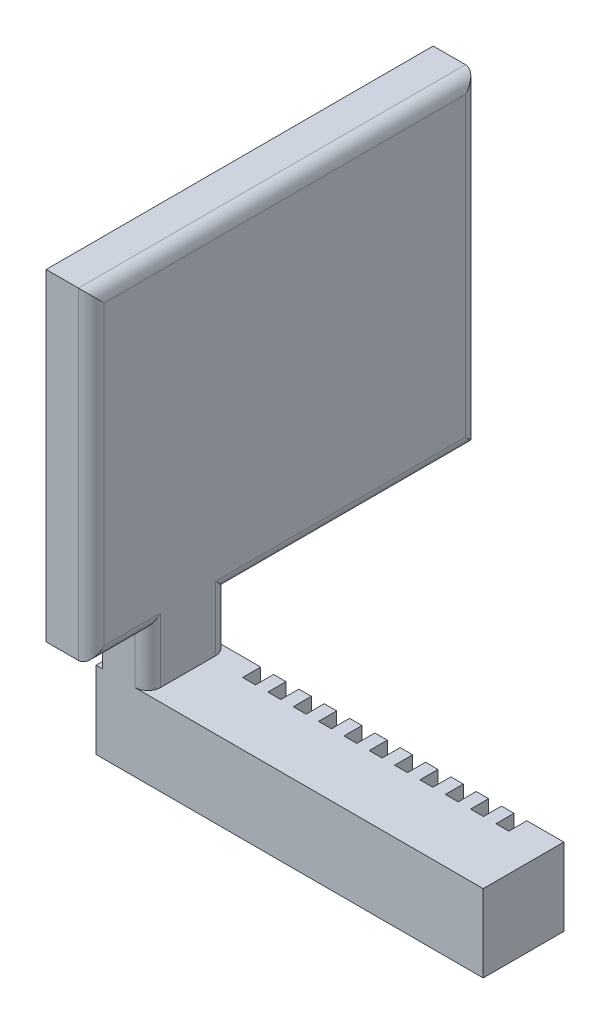
from build123d import *

# Parameters (mm, degrees)
SKETCH2_W           = 60
SKETCH2_H           = 50
BOSS_EXTRUDE1_DEPTH = 4
SKETCH3_W           = 8
SKETCH3_H           = 12.5
BOSS_EXTRUDE2_DEPTH = 20
FILLET2_R           = 2
CHAMFER2_SIZE       = 1
SKETCH4_W           = 60
SKETCH4_H           = 12.5
BOSS_EXTRUDE4_DEPTH = 12
SKETCH10_W          = 2
SKETCH10_H          = 2.8
CUT_EXTRUDE1_DEPTH  = 87.02325267
LPATTERN5_COUNT     = 11
LPATTERN5_PITCH     = 3.927


with BuildPart() as part:
    # Sketch2 → Boss-Extrude1 (new, symmetric)
    with BuildSketch(Plane(origin=(0, 0, 0), x_dir=(0, 0, -1), z_dir=(1, 0, 0))):
        Rectangle(SKETCH2_W, SKETCH2_H)
    extrude(amount=BOSS_EXTRUDE1_DEPTH, both=True)

    # Sketch3 → Boss-Extrude2 (add)
    with BuildSketch(Plane.XZ.offset(25)):
        with Locations((0, 15)):
            Rectangle(SKETCH3_W, SKETCH3_H)
    extrude(amount=BOSS_EXTRUDE2_DEPTH)

    # Fillet2
    fillet2_edges = [part.edges().sort_by_distance(p)[0] for p in [
        (4, 0, 30),
        (4, -25, -10.625),
        (4, -25, 25.625),
        (4, -35, 8.75),
        (4, -35, 21.25),
        (4, -45, 15),
        (4, 0, -30),
        (4, 25, 0),
    ]]
    fillet(fillet2_edges, radius=FILLET2_R)

    # Chamfer2
    chamfer2_edges = [part.edges().sort_by_distance(p)[0] for p in [
        (-4, -25, -10.625),
        (-4, -35, 21.25),
        (-4, -35, 8.75),
        (-4, -45, 15),
        (-4, -25, 25.625),
        (-4, 0, 30),
        (-4, 25, 0),
        (-4, 0, -30),
    ]]
    chamfer(chamfer2_edges, length=CHAMFER2_SIZE)

    # Sketch4 → Boss-Extrude4 (add)
    with BuildSketch(Plane.XZ.offset(45)):
        with Locations((26, 15)):
            Rectangle(SKETCH4_W, SKETCH4_H)
    extrude(amount=-BOSS_EXTRUDE4_DEPTH)

    # Sketch10 → Cut-Extrude1 (cut, symmetric)
    with BuildSketch(Plane(origin=(0, -33, 0), x_dir=(1, 0, 0), z_dir=(0, 1, 0))):
        with Locations((10, -10.15)):
            Rectangle(SKETCH10_W, SKETCH10_H)
    cut_extrude1 = extrude(amount=CUT_EXTRUDE1_DEPTH, both=True, mode=Mode.SUBTRACT)

    # LPattern5: Cut-Extrude1 ×11
    with Locations(*[(i * LPATTERN5_PITCH, 0, 0) for i in range(1, LPATTERN5_COUNT)]):
        add(cut_extrude1, mode=Mode.SUBTRACT)


solid = part.part
